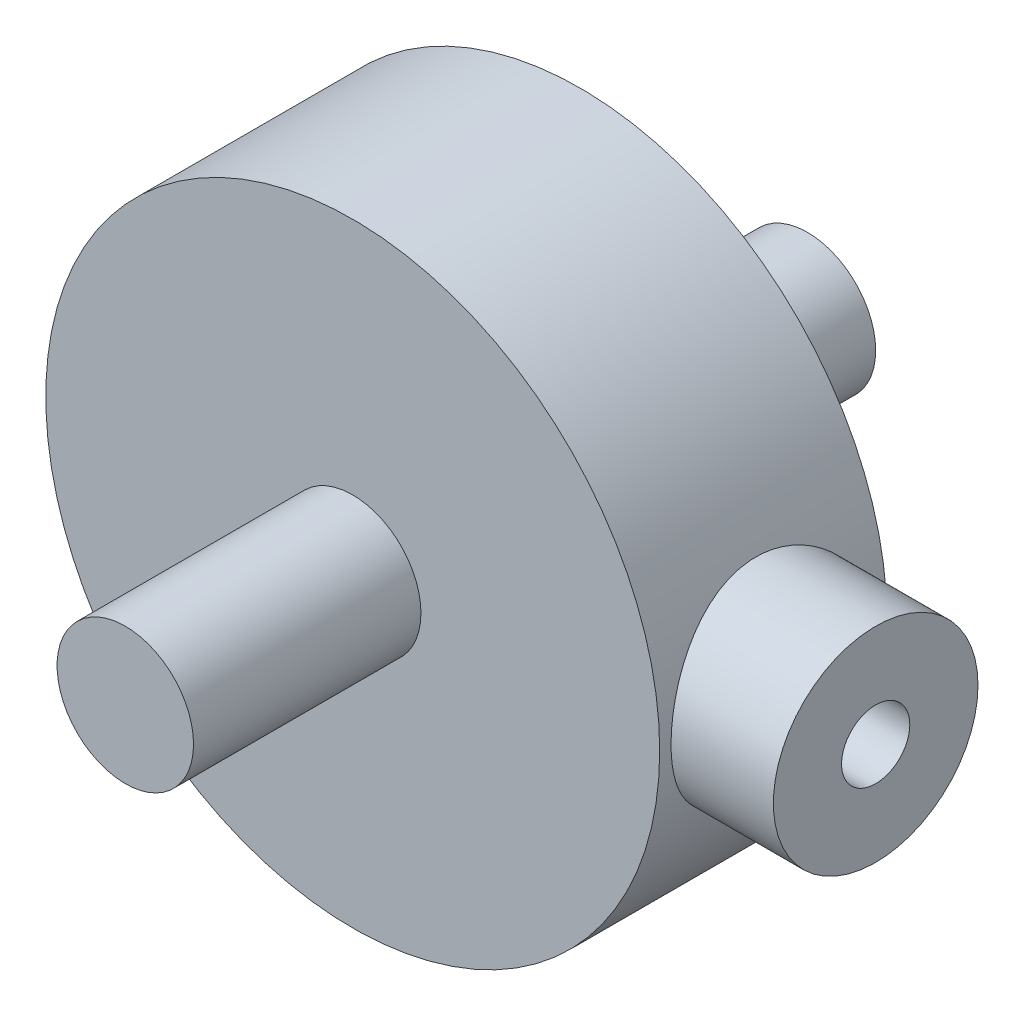
from build123d import *

# Parameters (mm, degrees)
BOSS_EXTRUDE1_DEPTH      = 8.33
BOSS_EXTRUDE1_DEPTH_BACK = 8.33
SKETCH1_R                = 22.5
BOSS_EXTRUDE2_START      = 10
SKETCH2_R                = 7.5
BOSS_EXTRUDE2_DEPTH      = 20
SKETCH3_R                = 2.5
CUT_EXTRUDE2_DEPTH       = 10
BOSS_EXTRUDE3_DEPTH      = 25
BOSS_EXTRUDE3_DEPTH_BACK = 25
SKETCH7_R                = 5


with BuildPart() as part:
    # Sketch1 → Boss-Extrude1 (new, two sides: drawn at the far end of the back side and taken through both)
    with BuildSketch(Plane.XY.offset(-BOSS_EXTRUDE1_DEPTH_BACK)):
        Circle(SKETCH1_R)
    extrude(amount=BOSS_EXTRUDE1_DEPTH + BOSS_EXTRUDE1_DEPTH_BACK)

    # Sketch2 → Boss-Extrude2 (add)
    with BuildSketch(Plane(origin=(0, 0, 0), x_dir=(0, 0, -1), z_dir=(1, 0, 0)).offset(BOSS_EXTRUDE2_START)):
        Circle(SKETCH2_R)
    extrude(amount=BOSS_EXTRUDE2_DEPTH)

    # Sketch3 → Cut-Extrude2 (cut)
    with BuildSketch(Plane(origin=(30, 0, 0), x_dir=(0, 0, -1), z_dir=(1, 0, 0))):
        Circle(SKETCH3_R)
    extrude(amount=-CUT_EXTRUDE2_DEPTH, mode=Mode.SUBTRACT)

    # Sketch7 → Boss-Extrude3 (add, two sides: drawn at the far end of the back side and taken through both)
    with BuildSketch(Plane.XY.offset(-BOSS_EXTRUDE3_DEPTH_BACK)):
        Circle(SKETCH7_R)
    extrude(amount=BOSS_EXTRUDE3_DEPTH + BOSS_EXTRUDE3_DEPTH_BACK)


solid = part.part
